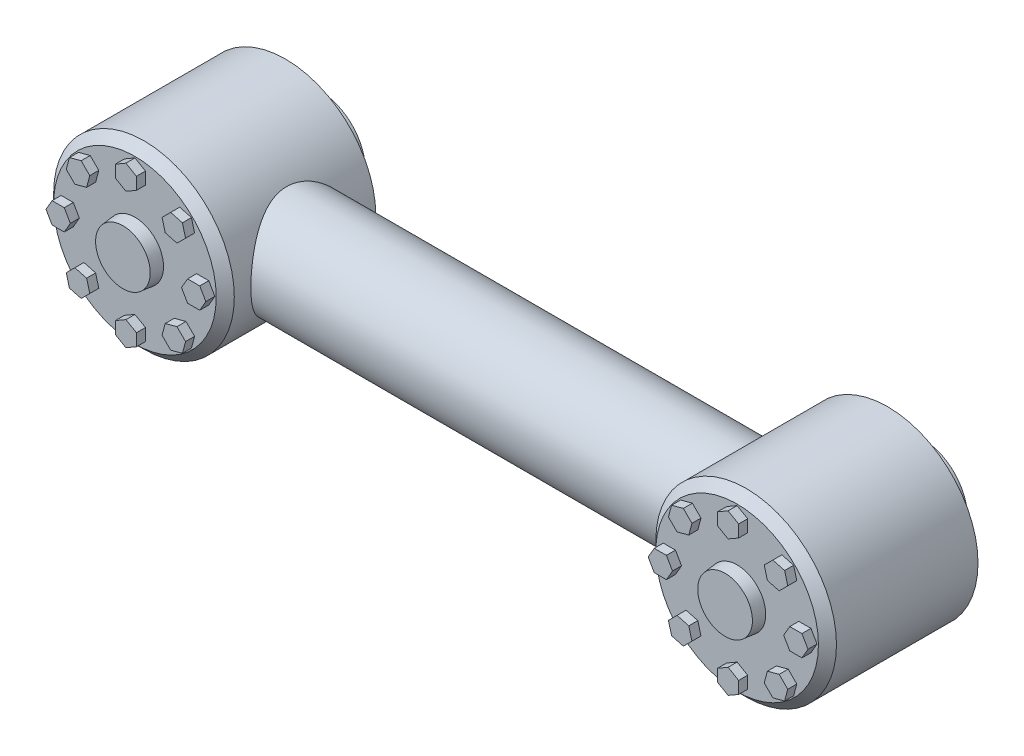
from build123d import *

# Parameters (mm, degrees)
SKETCH1_R                = 30
BOSS_EXTRUDE1_DEPTH      = 25
SKETCH2_R                = 15
BOSS_EXTRUDE2_DEPTH      = 11.5
BOSS_EXTRUDE3_DEPTH      = 3
CHAMFER1_SIZE            = 3
SKETCH4_R                = 17.5
BOSS_EXTRUDE4_DEPTH      = 200
CHAMFER1_OF_MIRROR1_SIZE = 3
SKETCH5_R                = 9.5
BOSS_EXTRUDE5_DEPTH      = 4
BOSS_EXTRUDE5_TAPER      = 6


with BuildPart() as part:
    # Sketch1 → Boss-Extrude1 (new, symmetric)
    with BuildSketch(Plane.XY):
        Circle(SKETCH1_R)
    boss_extrude1 = extrude(amount=BOSS_EXTRUDE1_DEPTH, both=True)

    # Sketch2 → Boss-Extrude2 (add)
    with BuildSketch(Plane(origin=(0, 0, -25), x_dir=(-1, 0, 0), z_dir=(0, 0, -1))):
        with Locations(Location((0, 0, 0), (0, 0, 180))):
            Circle(SKETCH2_R)
    boss_extrude2 = extrude(amount=BOSS_EXTRUDE2_DEPTH)

    # Sketch3 → Boss-Extrude3 (add)
    with BuildSketch(Plane.XY.offset(25)):
        Polygon((19.813645327, 14.863897859), (18.76764061, 18.76764061), (14.863897859, 19.813645327), (12.006159826, 16.955907294), (13.052164543, 13.052164543), (16.955907294, 12.006159826), align=None)
        Polygon((0, 18.458548116), (3.5, 20.479274058), (3.5, 24.520725942), (0, 26.541451884), (-3.5, 24.520725942), (-3.5, 20.479274058), align=None)
        Polygon((24.520725942, -3.5), (26.541451884, 0), (24.520725942, 3.5), (20.479274058, 3.5), (18.458548116, 0), (20.479274058, -3.5), align=None)
        Polygon((14.863897859, -19.813645327), (18.76764061, -18.76764061), (19.813645327, -14.863897859), (16.955907294, -12.006159826), (13.052164543, -13.052164543), (12.006159826, -16.955907294), align=None)
        Polygon((-3.5, -24.520725942), (0, -26.541451884), (3.5, -24.520725942), (3.5, -20.479274058), (0, -18.458548116), (-3.5, -20.479274058), align=None)
        Polygon((-19.813645327, -14.863897859), (-18.76764061, -18.76764061), (-14.863897859, -19.813645327), (-12.006159826, -16.955907294), (-13.052164543, -13.052164543), (-16.955907294, -12.006159826), align=None)
        Polygon((-24.520725942, 3.5), (-26.541451884, 0), (-24.520725942, -3.5), (-20.479274058, -3.5), (-18.458548116, 0), (-20.479274058, 3.5), align=None)
        Polygon((-14.863897859, 19.813645327), (-18.76764061, 18.76764061), (-19.813645327, 14.863897859), (-16.955907294, 12.006159826), (-13.052164543, 13.052164543), (-12.006159826, 16.955907294), align=None)
    boss_extrude3 = extrude(amount=BOSS_EXTRUDE3_DEPTH)

    # Chamfer1
    chamfer1_edges = [part.edges().sort_by_distance(p)[0] for p in [
        (-30, 0, 25),
    ]]
    chamfer(chamfer1_edges, length=CHAMFER1_SIZE)

    # Sketch4 → Boss-Extrude4 (add)
    with BuildSketch(Plane(origin=(0, 0, 0), x_dir=(0, 0, -1), z_dir=(1, 0, 0))):
        with Locations((1, 0)):
            Circle(SKETCH4_R)
    extrude(amount=BOSS_EXTRUDE4_DEPTH)

    # Mirror1: Boss-Extrude1 across plane
    add(boss_extrude1.mirror(Plane(origin=(100, 0, 0), x_dir=(0, 0, 1), z_dir=(1, 0, 0))))

    # Chamfer1 of Mirror1
    chamfer1_of_mirror1_edges = [part.edges().sort_by_distance(p)[0] for p in [
        (230, 0, 25),
    ]]
    chamfer(chamfer1_of_mirror1_edges, length=CHAMFER1_OF_MIRROR1_SIZE)

    # Mirror2: Boss-Extrude2, Boss-Extrude3 across plane
    add(boss_extrude2.mirror(Plane(origin=(100, 0, 0), x_dir=(0, 0, 1), z_dir=(1, 0, 0))))
    add(boss_extrude3.mirror(Plane(origin=(100, 0, 0), x_dir=(0, 0, 1), z_dir=(1, 0, 0))))

    # Sketch5 → Boss-Extrude5 (add)
    with BuildSketch(Plane.XY.offset(25)):
        Circle(SKETCH5_R)
    boss_extrude5 = extrude(amount=BOSS_EXTRUDE5_DEPTH, taper=BOSS_EXTRUDE5_TAPER)

    # Mirror3: Boss-Extrude5 across plane
    add(boss_extrude5.mirror(Plane(origin=(100, 0, 0), x_dir=(0, 0, 1), z_dir=(1, 0, 0))))


solid = part.part
